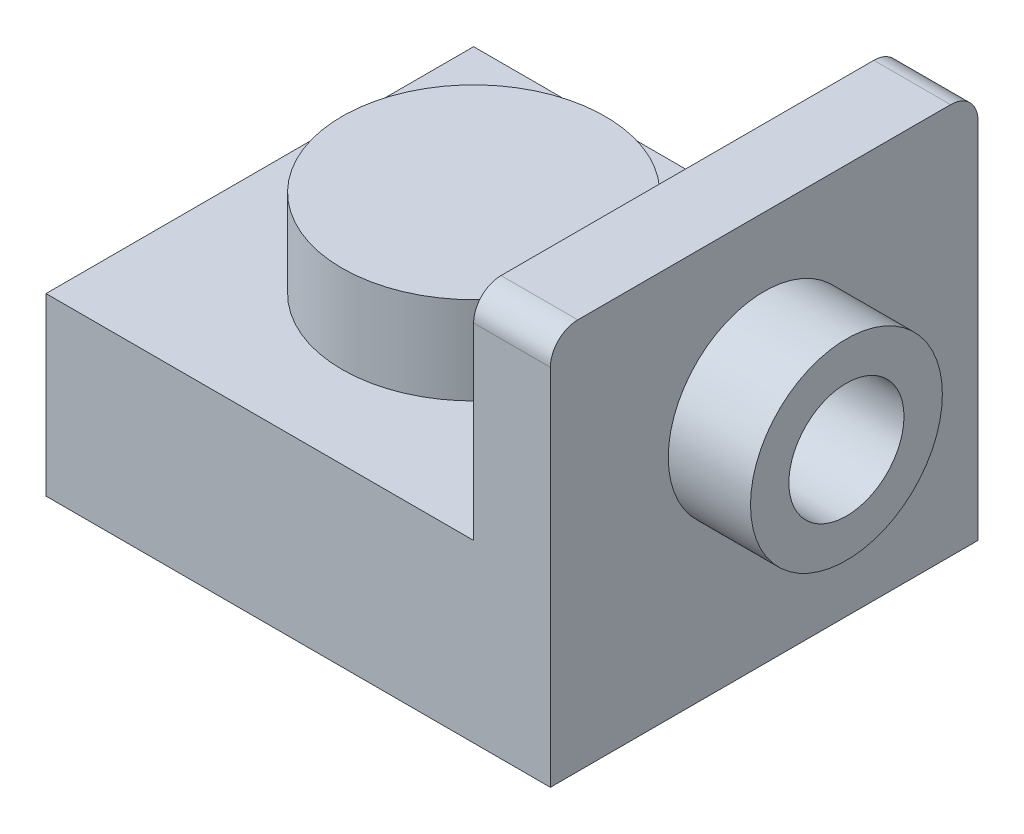
from build123d import *

# Parameters (mm, degrees)
SKETCH1_W           = 7.8
SKETCH1_H           = 3.2
BOSS_EXTRUDE1_DEPTH = 7.8
SKETCH2_R           = 2.4
BOSS_EXTRUDE2_DEPTH = 1.6
SKETCH3_W           = 6.5
SKETCH3_H           = 5.4
CUT_EXTRUDE1_DEPTH  = 3
SKETCH4_R           = 1.3
CUT_EXTRUDE2_DEPTH  = 1.7
SKETCH5_W           = 7.8
SKETCH5_H           = 7.134621369
BOSS_EXTRUDE3_DEPTH = 1.4
FILLET1_R           = 0.5
SKETCH6_R           = 1.75
SKETCH6_R_2         = 1.05
BOSS_EXTRUDE4_DEPTH = 1.5


with BuildPart() as part:
    # Sketch1 → Boss-Extrude1 (new body)
    with BuildSketch(Plane.XY):
        with Locations((3.9, 1.6)):
            Rectangle(SKETCH1_W, SKETCH1_H)
    extrude(amount=-BOSS_EXTRUDE1_DEPTH)

    # Sketch2 → Boss-Extrude2 (add)
    with BuildSketch(Plane(origin=(0, 3.2, 0), x_dir=(1, 0, 0), z_dir=(0, 1, 0))):
        with Locations(Location((3.9, 3.9, 0), (0, 0, 270))):
            Circle(SKETCH2_R)
    extrude(amount=BOSS_EXTRUDE2_DEPTH)

    # Sketch3 → Cut-Extrude1 (cut)
    with BuildSketch(Plane.XZ):
        with Locations((4.45, -3.9)):
            Rectangle(SKETCH3_W, SKETCH3_H)
    extrude(amount=-CUT_EXTRUDE1_DEPTH, mode=Mode.SUBTRACT)

    # Sketch4 → Cut-Extrude2 (cut)
    with BuildSketch(Plane.XZ.offset(-3)):
        with Locations(Location((3.9, -3.9, 0), (0, 0, 270))):
            Circle(SKETCH4_R)
    extrude(amount=-CUT_EXTRUDE2_DEPTH, mode=Mode.SUBTRACT)

    # Sketch5 → Boss-Extrude3 (add)
    with BuildSketch(Plane(origin=(7.8, 0, 0), x_dir=(0, 0, -1), z_dir=(1, 0, 0))):
        with Locations((3.9, 3.567310685)):
            Rectangle(SKETCH5_W, SKETCH5_H)
    extrude(amount=BOSS_EXTRUDE3_DEPTH)

    # Fillet1
    fillet1_edges = [part.edges().sort_by_distance(p)[0] for p in [
        (8.5, 7.134621369, -7.8),
        (8.5, 7.134621369, 0),
    ]]
    fillet(fillet1_edges, radius=FILLET1_R)

    # Sketch6 → Boss-Extrude4 (add)
    with BuildSketch(Plane(origin=(9.2, 0, 0), x_dir=(0, 0, -1), z_dir=(1, 0, 0))):
        with Locations(Location((3.9, 4.134621369, 0), (0, 0, 180))):
            Circle(SKETCH6_R)
        with Locations((3.9, 4.134621369)):
            Circle(SKETCH6_R_2, mode=Mode.SUBTRACT)
    extrude(amount=BOSS_EXTRUDE4_DEPTH)


solid = part.part
